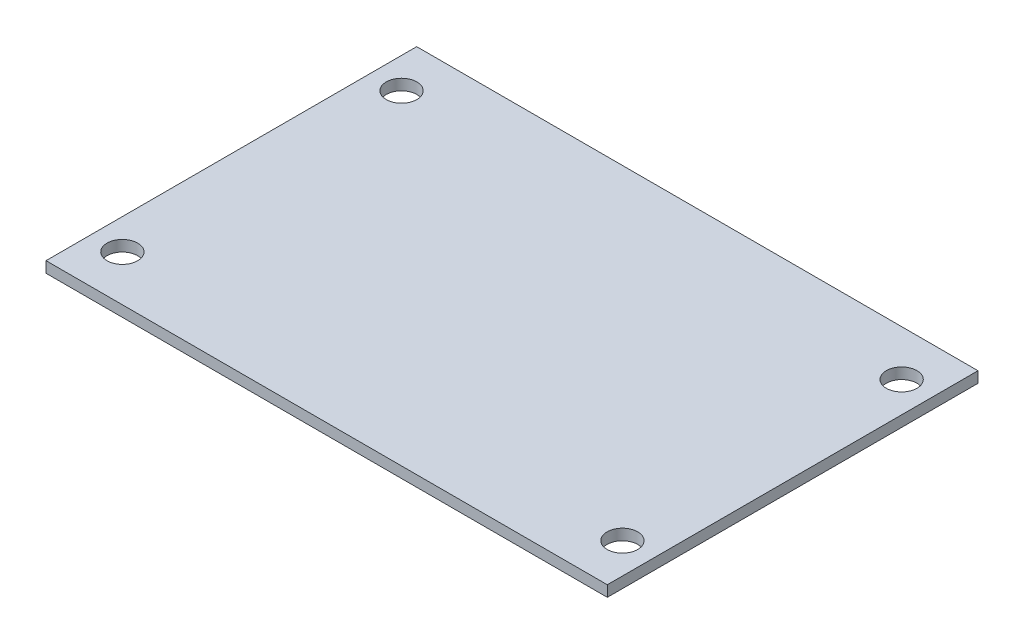
from build123d import *

# Parameters (mm, degrees)
CROQUIS1_W              = 77
CROQUIS1_H              = 50.85
SALIENTE_EXTRUIR1_DEPTH = 1.5
CROQUIS2_R              = 2.1
CORTAR_EXTRUIR1_DEPTH   = 47.162004127


with BuildPart() as part:
    # Croquis1 → Saliente-Extruir1 (new body)
    with BuildSketch(Plane(origin=(0, 0, 0), x_dir=(1, 0, 0), z_dir=(0, 1, 0))):
        Rectangle(CROQUIS1_W, CROQUIS1_H)
    extrude(amount=SALIENTE_EXTRUIR1_DEPTH)

    # Croquis2 → Cortar-Extruir1 (cut, through all)
    with BuildSketch(Plane(origin=(0, 1.5, 0), x_dir=(1, 0, 0), z_dir=(0, 1, 0))):
        with Locations(Location((-34.3, 19.15, 0), (0, 0, 270))):
            Circle(CROQUIS2_R)
        with Locations(Location((34.3, 19.15, 0), (0, 0, 270))):
            Circle(CROQUIS2_R)
        with Locations(Location((34.3, -19.15, 0), (0, 0, 270))):
            Circle(CROQUIS2_R)
        with Locations(Location((-34.3, -19.15, 0), (0, 0, 270))):
            Circle(CROQUIS2_R)
    extrude(amount=-CORTAR_EXTRUIR1_DEPTH, mode=Mode.SUBTRACT)


solid = part.part
